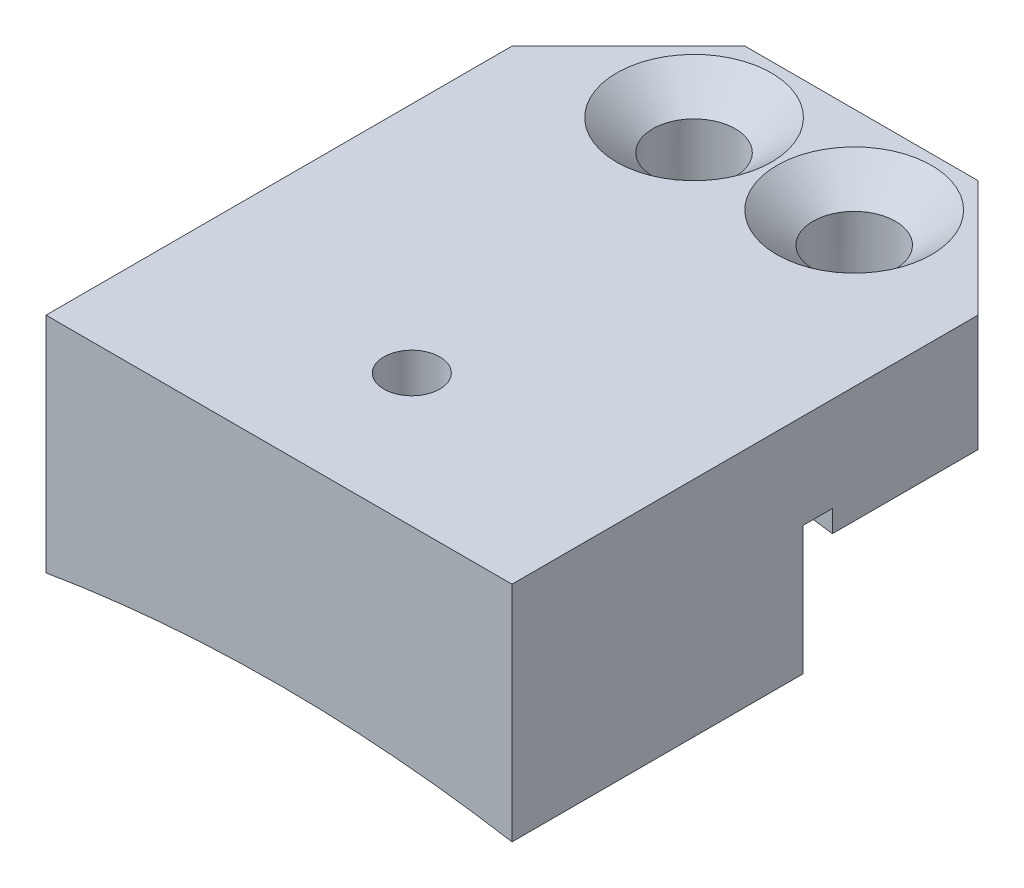
from build123d import *

# Parameters (mm, degrees)
SKETCH1_W                                         = 25.4
SKETCH1_H                                         = 31.75
BOSS_EXTRUDE1_DEPTH                               = 6.35
CUT_EXTRUDE1_DEPTH                                = 35.780382402
BOSS_EXTRUDE2_DEPTH                               = 15.875
SKETCH4_W                                         = 1.5875
SKETCH4_H                                         = 1.190625
CUT_EXTRUDE2_DEPTH                                = 31.618591166
CHAMFER1_SIZE                                     = 6.35
SKETCH5_R                                         = 1.524
CUT_EXTRUDE3_DEPTH                                = 24.692140063
CSK_FOR_8_FLAT_HEAD_MACHINE_SCREW_100_D           = 4.4958
CSK_FOR_8_FLAT_HEAD_MACHINE_SCREW_100_CSINK_D     = 8.4328
CSK_FOR_8_FLAT_HEAD_MACHINE_SCREW_100_CSINK_ANGLE = 100


with BuildPart() as part:
    # Sketch1 → Boss-Extrude1 (new body)
    with BuildSketch(Plane(origin=(0, 0, 0), x_dir=(1, 0, 0), z_dir=(0, 1, 0))):
        Rectangle(SKETCH1_W, SKETCH1_H)
    extrude(amount=BOSS_EXTRUDE1_DEPTH)

    # Sketch2 → Cut-Extrude1 (cut, through all)
    with BuildSketch(Plane.XY.offset(15.875)):
        with BuildLine():
            Line((-12.7, 0), (12.7, 0))
            ThreePointArc((12.7, 0), (0, 0.990173613), (-12.7, 0))
        make_face()
    extrude(amount=-CUT_EXTRUDE1_DEPTH, mode=Mode.SUBTRACT)

    # Sketch3 → Boss-Extrude2 (add)
    with BuildSketch(Plane.XY.offset(15.875)):
        with BuildLine():
            Line((-12.7, 6.35), (12.7, 6.35))
            Line((12.7, 6.35), (12.7, -5.816013142))
            ThreePointArc((12.7, -5.816013142), (0, -4.750226387), (-12.7, -5.816013142))
            Line((-12.7, -5.816013142), (-12.7, 6.35))
        make_face()
    extrude(amount=-BOSS_EXTRUDE2_DEPTH)

    # Sketch4 → Cut-Extrude2 (cut, through all)
    with BuildSketch(Plane.ZY.offset(12.7)):
        with Locations((-0.79375, 0.5953125)):
            Rectangle(SKETCH4_W, SKETCH4_H)
    extrude(amount=-CUT_EXTRUDE2_DEPTH, mode=Mode.SUBTRACT)

    # Chamfer1
    chamfer1_edges = [part.edges().sort_by_distance(p)[0] for p in [
        (-12.7, 3.175, -15.875),
        (12.7, 3.175, -15.875),
    ]]
    chamfer(chamfer1_edges, length=CHAMFER1_SIZE)

    # Sketch5 → Cut-Extrude3 (cut, through all)
    with BuildSketch(Plane(origin=(0, 6.35, 0), x_dir=(1, 0, 0), z_dir=(0, 1, 0))):
        with Locations(Location((0, -8.636, 0), (0, 0, 270))):
            Circle(SKETCH5_R)
    extrude(amount=-CUT_EXTRUDE3_DEPTH, mode=Mode.SUBTRACT)

    # CSK for #8 Flat Head Machine Screw (100)1 (through all)
    with Locations(Plane(origin=(0, 6.35, 0), x_dir=(1, 0, 0), z_dir=(0, 1, 0))):
        with Locations((-4.365625, 11.1125), (4.365625, 11.1125)):
            CounterSinkHole(CSK_FOR_8_FLAT_HEAD_MACHINE_SCREW_100_D / 2, CSK_FOR_8_FLAT_HEAD_MACHINE_SCREW_100_CSINK_D / 2, counter_sink_angle=CSK_FOR_8_FLAT_HEAD_MACHINE_SCREW_100_CSINK_ANGLE)


solid = part.part
